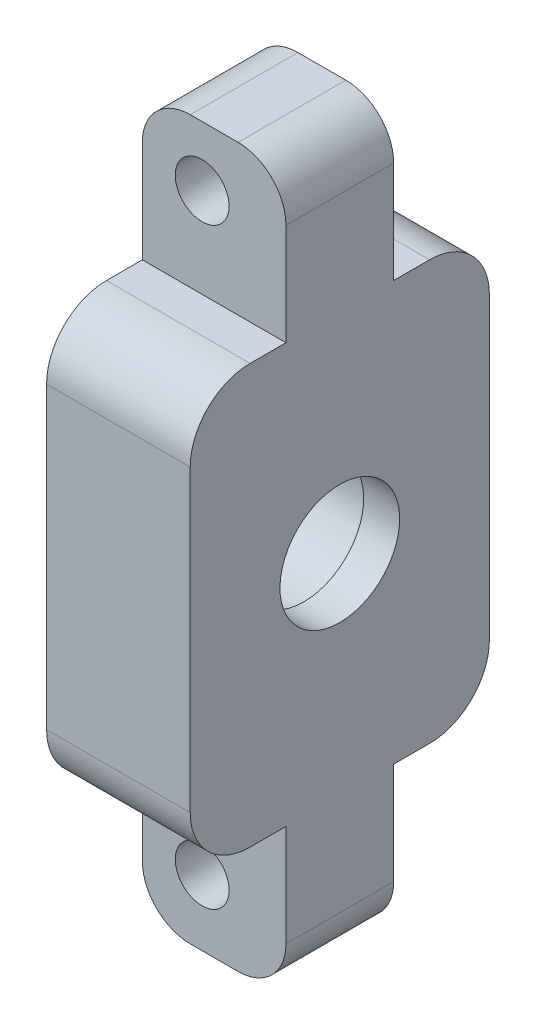
from build123d import *

# Parameters (mm, degrees)
SKETCH2_W           = 12
SKETCH2_H           = 60
BOSS_EXTRUDE1_DEPTH = 12.5
SKETCH3_W           = 8
SKETCH3_H           = 12.5
CUT_EXTRUDE1_DEPTH  = 35.644624403
SKETCH4_R           = 2.25
CUT_EXTRUDE2_DEPTH  = 36
FILLET1_R           = 5
FILLET2_R           = 4
CUT_EXTRUDE3_START  = -8
SKETCH5_R           = 5
CUT_EXTRUDE3_DEPTH  = 4
SKETCH6_R           = 7.5
CUT_EXTRUDE4_DEPTH  = 4
SKETCH8_R           = 5.5
CUT_EXTRUDE6_DEPTH  = 5


with BuildPart() as part:
    # Sketch2 → Boss-Extrude1 (new, symmetric)
    with BuildSketch(Plane.XY):
        Rectangle(SKETCH2_W, SKETCH2_H)
    extrude(amount=BOSS_EXTRUDE1_DEPTH, both=True)

    # Sketch3 → Cut-Extrude1 (cut, through all)
    with BuildSketch(Plane(origin=(6, 0, 0), x_dir=(0, 0, -1), z_dir=(1, 0, 0))):
        with Locations((-8.5, -23.75)):
            Rectangle(SKETCH3_W, SKETCH3_H)
        with Locations((8.5, -23.75)):
            Rectangle(SKETCH3_W, SKETCH3_H)
        with Locations((8.5, 23.75)):
            Rectangle(SKETCH3_W, SKETCH3_H)
        with Locations((-8.5, 23.75)):
            Rectangle(SKETCH3_W, SKETCH3_H)
    extrude(amount=-CUT_EXTRUDE1_DEPTH, mode=Mode.SUBTRACT)

    # Sketch4 → Cut-Extrude2 (cut, through all)
    with BuildSketch(Plane.XY.offset(4.5)):
        with Locations((-1, 25)):
            Circle(SKETCH4_R)
        with Locations((-1, -24.5)):
            Circle(SKETCH4_R)
    extrude(amount=-CUT_EXTRUDE2_DEPTH, mode=Mode.SUBTRACT)

    # Fillet1
    fillet1_edges = [part.edges().sort_by_distance(p)[0] for p in [
        (0, 17.5, 12.5),
        (0, 17.5, -12.5),
        (0, -17.5, -12.5),
        (0, -17.5, 12.5),
    ]]
    fillet(fillet1_edges, radius=FILLET1_R)

    # Fillet2
    fillet2_edges = [part.edges().sort_by_distance(p)[0] for p in [
        (6, -30, 0),
        (-6, -30, 0),
        (-6, 30, 0),
        (6, 30, 0),
    ]]
    fillet(fillet2_edges, radius=FILLET2_R)

    # Sketch5 → Cut-Extrude3 (cut)
    with BuildSketch(Plane.ZY.offset(6).offset(CUT_EXTRUDE3_START)):
        with Locations(Location((0, 0, 0), (0, 0, 270))):
            Circle(SKETCH5_R)
    extrude(amount=-CUT_EXTRUDE3_DEPTH, mode=Mode.SUBTRACT)

    # Sketch6 → Cut-Extrude4 (cut)
    with BuildSketch(Plane.ZY.offset(6)):
        with Locations(Location((0, 0, 0), (0, 0, 270))):
            Circle(SKETCH6_R)
    extrude(amount=-CUT_EXTRUDE4_DEPTH, mode=Mode.SUBTRACT)

    # Sketch8 → Cut-Extrude6 (cut)
    with BuildSketch(Plane.ZY.offset(2)):
        with Locations(Location((0, 0, 0), (0, 0, 270))):
            Circle(SKETCH8_R)
    extrude(amount=-CUT_EXTRUDE6_DEPTH, mode=Mode.SUBTRACT)


solid = part.part
